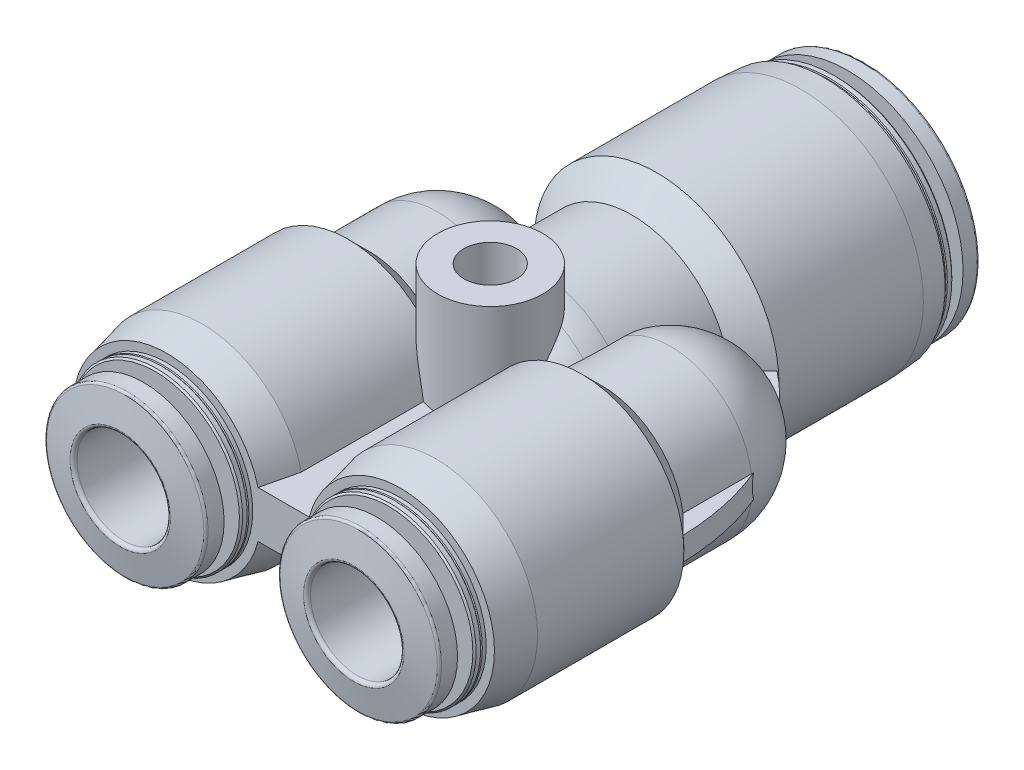
from build123d import *

# Parameters (mm, degrees)
AUFSATZ_LINEAR_AUSTRAGEN1_DEPTH      = 2
AUFSATZ_LINEAR_AUSTRAGEN1_DEPTH_BACK = 2
SKIZZE2_W                            = 6
SKIZZE2_H                            = 17.7
AUFSATZ_LINEAR_AUSTRAGEN2_DEPTH      = 1
AUFSATZ_LINEAR_AUSTRAGEN2_DEPTH_BACK = 1
SKIZZE6_W                            = 4.5
SKIZZE6_H                            = 21.7
SKIZZE7_W                            = 2.25
SKIZZE7_H                            = 21.7


with BuildPart() as part:
    # Skizze1 → Rotation1 (revolve)
    with BuildSketch(Plane(origin=(0, 0, 0), x_dir=(0, 0, -1), z_dir=(1, 0, 0))):
        with BuildLine():
            Line((-3, 0), (-3, 1))
            Line((-3, 1), (-1, 1))
            Line((-1, 1), (-1, 4.2848570571257))
            ThreePointArc((-1, 4.2848570571257), (-0.1333978072025852, 6.771183299157964), (2.0909090909090997, 8.1801816545127))
            ThreePointArc((2.0909090909090997, 8.1801816545127), (3.039147747545664, 8.344864465583196), (4, 8.4))
            Line((4, 8.4), (12.14, 8.4))
            Line((12.14, 8.4), (14.239999999999998, 10.5))
            Line((14.239999999999998, 10.5), (26.599999999999998, 10.5))
            Line((26.599999999999998, 10.5), (28.6, 10.360146376113))
            Line((28.6, 10.360146376113), (28.6, 10.08))
            Line((28.6, 10.08), (28.929289321881, 10.08))
            Line((28.929289321881, 10.08), (29, 10.009289321881))
            Line((29, 10.009289321881), (29.070710678119003, 10.08))
            Line((29.070710678119003, 10.08), (29.458578643763, 10.08))
            Line((29.458578643763, 10.08), (29.6, 9.9385786437627))
            Line((29.6, 9.9385786437627), (29.6, 6.7))
            Line((29.6, 6.7), (30.224999999999998, 6.7))
            ThreePointArc((30.224999999999998, 6.7), (30.490165042944998, 6.809834957055), (30.599999999999998, 7.074999999999999))
            Line((30.599999999999998, 7.074999999999999), (30.599999999999998, 9.9))
            Line((30.599999999999998, 9.9), (31.797402943214003, 9.9))
            ThreePointArc((31.797402943214003, 9.9), (31.925960465151288, 9.853208888623552), (31.994364493817, 9.7347296355334))
            Line((31.994364493817, 9.7347296355334), (32.599999999999994, 6.3))
            Line((32.599999999999994, 6.3), (32.599999999999994, 0))
            Line((32.599999999999994, 0), (-3, 0))
        make_face()
    revolve(axis=Axis((0, 0, -32.599999999999994), (0, 0, 1)))

    # Skizze2 → Aufsatz-Linear austragen1 (add, two sides: drawn at the far end of the back side and taken through both)
    with BuildSketch(Plane(origin=(0, 0, 0), x_dir=(1, 0, 0), z_dir=(0, 1, 0)).offset(-AUFSATZ_LINEAR_AUSTRAGEN1_DEPTH_BACK)):
        with Locations((0, -8.85)):
            Rectangle(SKIZZE2_W, SKIZZE2_H)
    extrude(amount=AUFSATZ_LINEAR_AUSTRAGEN1_DEPTH + AUFSATZ_LINEAR_AUSTRAGEN1_DEPTH_BACK)

    # Skizze3 → Rotation2 (revolve)
    with BuildSketch(Plane(origin=(-10, 0, 0), x_dir=(0, 0, -1), z_dir=(1, 0, 0))):
        with BuildLine():
            Line((-21.7, 0), (-21.7, 4.3))
            Line((-21.7, 4.3), (-21.270691474525, 6.7347296355334))
            ThreePointArc((-21.270691474525, 6.7347296355334), (-21.20228744586009, 6.853208888623726), (-21.073729923923, 6.8999999999999995))
            Line((-21.073729923923, 6.8999999999999995), (-19.7, 6.8999999999999995))
            Line((-19.7, 6.8999999999999995), (-19.7, 5.074999999999999))
            ThreePointArc((-19.7, 5.074999999999999), (-19.590165042945, 4.809834957054999), (-19.325, 4.7))
            Line((-19.325, 4.7), (-18.700000000000003, 4.7))
            Line((-18.700000000000003, 4.7), (-18.700000000000003, 7.208578643762699))
            Line((-18.700000000000003, 7.208578643762699), (-18.558578643763, 7.35))
            Line((-18.558578643763, 7.35), (-18.170710678119, 7.35))
            Line((-18.170710678119, 7.35), (-18.1, 7.2792893218813))
            Line((-18.1, 7.2792893218813), (-18.029289321881002, 7.35))
            Line((-18.029289321881002, 7.35), (-17.7, 7.35))
            Line((-17.7, 7.35), (-17.7, 8.0573954266233))
            Line((-17.7, 8.0573954266233), (-14.7, 8.75))
            Line((-14.7, 8.75), (-2.17, 8.75))
            Line((-2.17, 8.75), (-0.42000000000001, 7))
            Line((-0.42000000000001, 7), (5.45, 7))
            ThreePointArc((5.45, 7), (10.3997474683059, 4.9497474683059), (12.45, 0))
            Line((12.45, 0), (-21.7, 0))
        make_face()
    revolve(axis=Axis((-10, 0, -12.45), (0, 0, 1)))

    # Skizze4 → Rotation3 (revolve)
    with BuildSketch(Plane(origin=(10, 0, 0), x_dir=(0, 0, -1), z_dir=(1, 0, 0))):
        with BuildLine():
            Line((-21.7, 0), (-21.7, 4.3))
            Line((-21.7, 4.3), (-21.270691474525, 6.7347296355334))
            ThreePointArc((-21.270691474525, 6.7347296355334), (-21.20228744586009, 6.853208888623726), (-21.073729923923, 6.8999999999999995))
            Line((-21.073729923923, 6.8999999999999995), (-19.7, 6.8999999999999995))
            Line((-19.7, 6.8999999999999995), (-19.7, 5.074999999999999))
            ThreePointArc((-19.7, 5.074999999999999), (-19.590165042945, 4.809834957054999), (-19.325, 4.7))
            Line((-19.325, 4.7), (-18.700000000000003, 4.7))
            Line((-18.700000000000003, 4.7), (-18.700000000000003, 7.208578643762699))
            Line((-18.700000000000003, 7.208578643762699), (-18.558578643763, 7.35))
            Line((-18.558578643763, 7.35), (-18.170710678119, 7.35))
            Line((-18.170710678119, 7.35), (-18.1, 7.2792893218813))
            Line((-18.1, 7.2792893218813), (-18.029289321881002, 7.35))
            Line((-18.029289321881002, 7.35), (-17.7, 7.35))
            Line((-17.7, 7.35), (-17.7, 8.0573954266233))
            Line((-17.7, 8.0573954266233), (-14.7, 8.75))
            Line((-14.7, 8.75), (-2.17, 8.75))
            Line((-2.17, 8.75), (-0.42000000000001, 7))
            Line((-0.42000000000001, 7), (5.45, 7))
            ThreePointArc((5.45, 7), (10.3997474683059, 4.9497474683059), (12.45, 0))
            Line((12.45, 0), (-21.7, 0))
        make_face()
    revolve(axis=Axis((10, 0, -12.45), (0, 0, 1)))

    # Skizze5 → Aufsatz-Linear austragen2 (add, two sides: drawn at the far end of the back side and taken through both)
    with BuildSketch(Plane(origin=(0, 0, 0), x_dir=(1, 0, 0), z_dir=(0, 1, 0)).offset(-AUFSATZ_LINEAR_AUSTRAGEN2_DEPTH_BACK)):
        with BuildLine():
            Line((-18.55, -2.17), (18.55, -2.17))
            ThreePointArc((18.55, -2.17), (16.30554806185193, 6.980430926890823), (10.3, 14.239999999999998))
            Line((10.3, 14.239999999999998), (-10.3, 14.239999999999998))
            ThreePointArc((-10.3, 14.239999999999998), (-16.305548061851926, 6.98043092689082), (-18.55, -2.17))
        make_face()
    extrude(amount=AUFSATZ_LINEAR_AUSTRAGEN2_DEPTH + AUFSATZ_LINEAR_AUSTRAGEN2_DEPTH_BACK)

    # Skizze6 → Rotation4 (revolve)
    with BuildSketch(Plane(origin=(0, 0, 0), x_dir=(0, 0, -1), z_dir=(1, 0, 0))):
        with Locations((2.25, 0)):
            Rectangle(SKIZZE6_W, SKIZZE6_H)
    revolve(axis=Axis((0, -10.85, 0), (0, 1, 0)))

    # Skizze7 → Schnitt-Rotation1 (revolve, cut)
    with BuildSketch(Plane(origin=(0, 0, 0), x_dir=(0, 0, -1), z_dir=(1, 0, 0))):
        with Locations((1.125, 0)):
            Rectangle(SKIZZE7_W, SKIZZE7_H)
    revolve(axis=Axis((0, -10.85, 0), (0, 1, 0)), mode=Mode.SUBTRACT)

    # Skizze8 → Schnitt-Rotation2 (revolve, cut)
    with BuildSketch(Plane(origin=(-10, 0, 0), x_dir=(0, 0, -1), z_dir=(1, 0, 0))):
        with BuildLine():
            Line((-21.7, 0), (-21.7, 4.3))
            ThreePointArc((-21.7, 4.3), (-21.612132034355998, 4.087867965644), (-21.4, 4))
            Line((-21.4, 4), (-3.6, 4))
            Line((-3.6, 4), (-3.6, 0))
            Line((-3.6, 0), (-21.7, 0))
        make_face()
    revolve(axis=Axis((-10, 0, 3.6), (0, 0, 1)), mode=Mode.SUBTRACT)

    # Skizze9 → Schnitt-Rotation3 (revolve, cut)
    with BuildSketch(Plane(origin=(10, 0, 0), x_dir=(0, 0, -1), z_dir=(1, 0, 0))):
        with BuildLine():
            Line((-21.7, 0), (-21.7, 4.3))
            ThreePointArc((-21.7, 4.3), (-21.612132034355998, 4.087867965644), (-21.4, 4))
            Line((-21.4, 4), (-3.6, 4))
            Line((-3.6, 4), (-3.6, 0))
            Line((-3.6, 0), (-21.7, 0))
        make_face()
    revolve(axis=Axis((10, 0, 3.6), (0, 0, 1)), mode=Mode.SUBTRACT)

    # Skizze10 → Schnitt-Rotation4 (revolve, cut)
    with BuildSketch(Plane(origin=(0, 0, 0), x_dir=(0, 0, -1), z_dir=(1, 0, 0))):
        with BuildLine():
            Line((9.2, 0), (9.2, 6))
            Line((9.2, 6), (32.300000000000004, 6))
            ThreePointArc((32.300000000000004, 6), (32.512132034356, 6.087867965643999), (32.599999999999994, 6.3))
            Line((32.599999999999994, 6.3), (32.599999999999994, 0))
            Line((32.599999999999994, 0), (9.2, 0))
        make_face()
    revolve(axis=Axis((0, 0, -32.599999999999994), (0, 0, 1)), mode=Mode.SUBTRACT)


solid = part.part
